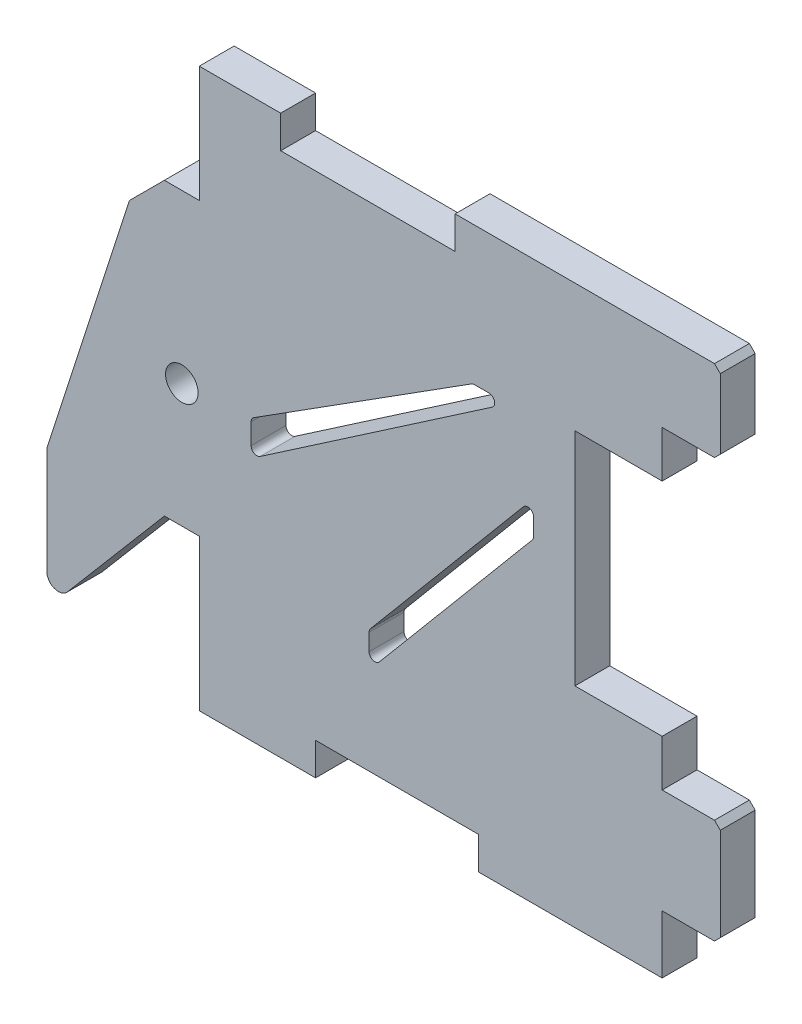
from build123d import *

# Parameters (mm, degrees)
SKETCH_1_R          = 1.8
EXTRUDE_1_DEPTH     = 3
SKETCH_2_W          = 3
SKETCH_2_H          = 27
CUT_EXTRUDE_1_DEPTH = 2
SKETCH_3_W          = 6
SKETCH_3_H          = 3
EXTRUDE_2_DEPTH     = 5
SKETCH_4_W          = 6
SKETCH_4_H          = 3
EXTRUDE_3_DEPTH     = 5
SKETCH_5_W          = 6
SKETCH_5_H          = 3
CUT_EXTRUDE_2_DEPTH = 1
SKETCH_6_W          = 6
SKETCH_6_H          = 3
CUT_EXTRUDE_3_DEPTH = 1
SKETCH_8_W          = 3
SKETCH_8_H          = 19
CUT_EXTRUDE_4_DEPTH = 1.5
EXTRUDE_5_DEPTH     = 3
FILLET_2_R          = 1
CHAMFER_1_SIZE      = 0.5
EXTRUDE_START       = -3
SKETCH_11_R         = 1.8
EXTRUDE_6_DEPTH     = 3
SKETCH_12_R         = 1.4
CUT_EXTRUDE_5_DEPTH = 3


with BuildPart() as part:
    # 草图1 → 凸台-拉伸1 (new body)
    with BuildSketch(Plane.XY):
        Polygon((24.9, -12.5), (15.9, -12.5), (15.9, 14.5), (24.9, 14.5), (24.9, 21.5), (2.1, 21.5), (2.1, 18.7), (-12.9, 18.7), (-12.9, 21.5), (-19.9, 21.5), (-19.9, 11.5), (-22.9, 11.5), (-25.9, 8.5), (-25.9, -10.5), (-22.9, -13.5), (-19.9, -13.5), (-19.9, -26.5), (-9.9, -26.5), (-9.9, -23.7), (4.1, -23.7), (4.1, -26.5), (19.9, -26.5), (19.9, -21.5), (24.9, -21.5), align=None)
        with Locations((-21.4, -1.053344625)):
            Circle(SKETCH_1_R, mode=Mode.SUBTRACT)
        with BuildLine():
            Line((3.499503129, 9.537046136), (-15.209877372, -2.33076439))
            ThreePointArc((-15.209877372, -2.33076439), (-15.380180828, -2.512061787), (-15.442052841, -2.752984736))
            Line((-15.442052841, -2.752984736), (-15.442052841, -4.530228968))
            ThreePointArc((-15.442052841, -4.530228968), (-15.175347113, -4.972466215), (-14.65975771, -4.942914635))
            Line((-14.65975771, -4.942914635), (5.287871242, 8.702140123))
            ThreePointArc((5.287871242, 8.702140123), (5.483249029, 9.262570784), (5.005576111, 9.61482579))
            Line((5.005576111, 9.61482579), (3.767327661, 9.61482579))
            ThreePointArc((3.767327661, 9.61482579), (3.627882641, 9.594987311), (3.499503129, 9.537046136))
        make_face(mode=Mode.SUBTRACT)
        with BuildLine():
            Line((7.966853478, 2.623077919), (-5.180839485, -13.033716755))
            ThreePointArc((-5.180839485, -13.033716755), (-5.267752705, -13.184156416), (-5.297938704, -13.355255232))
            Line((-5.297938704, -13.355255232), (-5.297938704, -14.80023138))
            ThreePointArc((-5.297938704, -14.80023138), (-4.96903752, -15.270045381), (-4.415037923, -15.121769857))
            Line((-4.415037923, -15.121769857), (8.732655041, 0.535024817))
            ThreePointArc((8.732655041, 0.535024817), (8.81956826, 0.685464478), (8.849754259, 0.856563293))
            Line((8.849754259, 0.856563293), (8.849754259, 2.301539442))
            ThreePointArc((8.849754259, 2.301539442), (8.520853075, 2.771353443), (7.966853478, 2.623077919))
        make_face(mode=Mode.SUBTRACT)
    extrude(amount=EXTRUDE_1_DEPTH)

    # 草图2 → 切除-拉伸1 (cut)
    with BuildSketch(Plane(origin=(15.9, 0, 0), x_dir=(0, 0, -1), z_dir=(1, 0, 0))):
        with Locations((-1.5, 1)):
            Rectangle(SKETCH_2_W, SKETCH_2_H)
    extrude(amount=-CUT_EXTRUDE_1_DEPTH, mode=Mode.SUBTRACT)

    # 草图3 → 凸台-拉伸2 (add)
    with BuildSketch(Plane.XZ.offset(-14.5)):
        with Locations((16.9, 1.5)):
            Rectangle(SKETCH_3_W, SKETCH_3_H)
    extrude(amount=EXTRUDE_2_DEPTH)

    # 草图4 → 凸台-拉伸3 (add)
    with BuildSketch(Plane(origin=(0, -12.5, 0), x_dir=(1, 0, 0), z_dir=(0, 1, 0))):
        with Locations((16.9, -1.5)):
            Rectangle(SKETCH_4_W, SKETCH_4_H)
    extrude(amount=EXTRUDE_3_DEPTH)

    # 草图5 → 切除-拉伸2 (cut)
    with BuildSketch(Plane(origin=(0, -7.5, 0), x_dir=(1, 0, 0), z_dir=(0, 1, 0))):
        with Locations((16.9, -1.5)):
            Rectangle(SKETCH_5_W, SKETCH_5_H)
    extrude(amount=-CUT_EXTRUDE_2_DEPTH, mode=Mode.SUBTRACT)

    # 草图6 → 切除-拉伸3 (cut)
    with BuildSketch(Plane.XZ.offset(-9.5)):
        with Locations((16.9, 1.5)):
            Rectangle(SKETCH_6_W, SKETCH_6_H)
    extrude(amount=-CUT_EXTRUDE_3_DEPTH, mode=Mode.SUBTRACT)

    # 草图8 → 切除-拉伸4 (cut)
    with BuildSketch(Plane(origin=(13.9, 0, 0), x_dir=(0, 0, -1), z_dir=(1, 0, 0))):
        with Locations((-1.5, 1)):
            Rectangle(SKETCH_8_W, SKETCH_8_H)
    extrude(amount=-CUT_EXTRUDE_4_DEPTH, mode=Mode.SUBTRACT)

    # 草图10 → 凸台-拉伸5 (add)
    with BuildSketch(Plane.XY.offset(3)):
        Polygon((-25.9, -10.5), (-22.9, -13.5), (-33.008159317, -25.40304294), (-33.008159317, -13.5), (-25.9, 8.5), align=None)
    extrude(amount=-EXTRUDE_5_DEPTH)

    # 圆角2
    fillet_2_edges = [part.edges().sort_by_distance(p)[0] for p in [
        (-33.008159317, -25.40304294, 1.5),
    ]]
    fillet(fillet_2_edges, radius=FILLET_2_R)

    # 倒角1
    chamfer_1_edges = [part.edges().sort_by_distance(p)[0] for p in [
        (24.9, -21.5, 1.5),
        (24.9, 21.5, 1.5),
        (24.9, 14.5, 1.5),
        (24.9, -12.5, 1.5),
    ]]
    chamfer(chamfer_1_edges, length=CHAMFER_1_SIZE)

    # 草图11 → 凸台-拉伸6 (add)
    with BuildSketch(Plane.XY.offset(3).offset(EXTRUDE_START)):
        with Locations((-21.4, -1.053344625)):
            Circle(SKETCH_11_R)
    extrude(amount=EXTRUDE_6_DEPTH)

    # 草图12 → 切除-拉伸5 (cut)
    with BuildSketch(Plane(origin=(175.843153128, -50.872452405, 3), x_dir=(1, 0, 0), z_dir=(0, 0, 1))):
        with Locations((-197.243153128, 47.987065257)):
            Circle(SKETCH_12_R)
    extrude(amount=-CUT_EXTRUDE_5_DEPTH, mode=Mode.SUBTRACT)


solid = part.part
